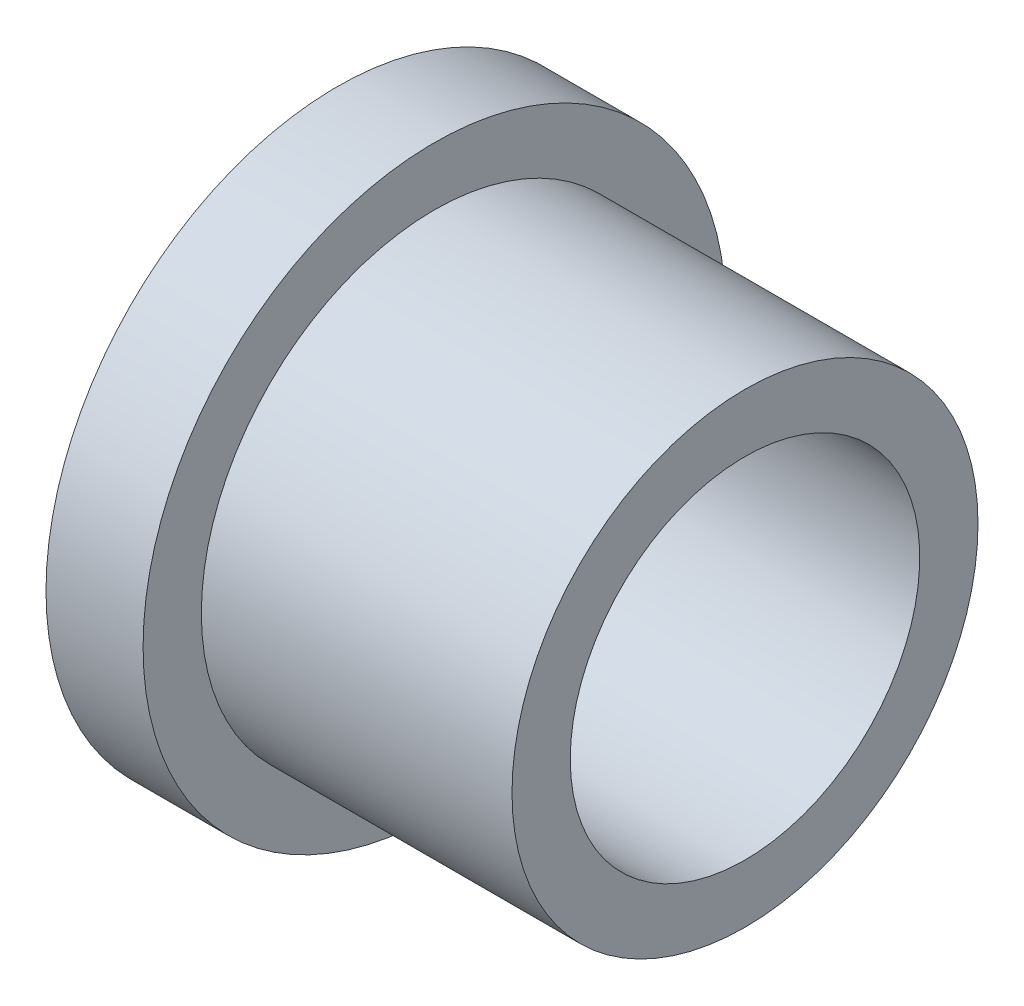
from build123d import *


with BuildPart() as part:
    # Sketch1 → Revolve1 (revolve)
    with BuildSketch(Plane.XY, mode=Mode.PRIVATE) as revolve1_sk:
        Polygon((-10.5, 9), (-10.5, 15), (-5.5, 15), (-5.5, 12), (10.5, 12), (10.5, 9), align=None)
    revolve(revolve1_sk.sketch.rotate(Axis((-10.5, 0, 0), (1, 0, 0)), 90), axis=Axis((-10.5, 0, 0), (1, 0, 0)))


solid = part.part
